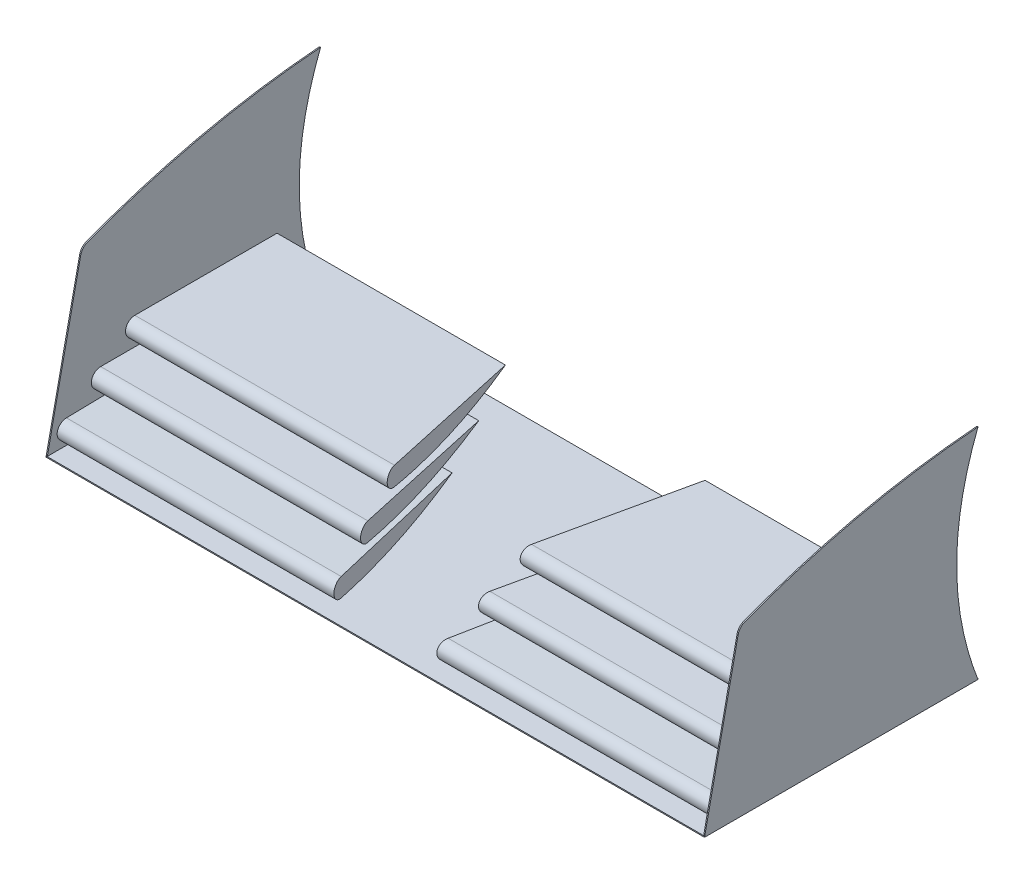
from build123d import *

# Parameters (mm, degrees)
BOSS_EXTRUDE1_START      = 762
SKETCH1_W                = 635
SKETCH1_H                = 508
BOSS_EXTRUDE1_DEPTH      = 2.54
CUT_EXTRUDE1_DEPTH       = 1117.158775265
CUT_EXTRUDE1_DEPTH_BACK  = 1117.158775265
CUT_EXTRUDE2_DEPTH       = 1117.158775435
CUT_EXTRUDE2_DEPTH_BACK  = 1117.158775435
BOSS_EXTRUDE2_DEPTH      = 762
BOSS_EXTRUDE2_DEPTH_BACK = 764.54
SKETCH6_W                = 1529.0800025
SKETCH6_H                = 635
BOSS_EXTRUDE3_DEPTH      = 2.54
CUT_EXTRUDE3_DEPTH       = 182.122850144


with BuildPart() as part:
    # Sketch1 → Boss-Extrude1 (new body)
    with BuildSketch(Plane(origin=(0, 0, 0), x_dir=(0, 0, -1), z_dir=(1, 0, 0)).offset(BOSS_EXTRUDE1_START)):
        with Locations((317.5, 254)):
            Rectangle(SKETCH1_W, SKETCH1_H)
    extrude(amount=BOSS_EXTRUDE1_DEPTH)


with BuildPart() as body_2:
    # Mirror2: mirrored copy
    add(part.part.mirror(Plane(origin=(0, 0, 0), x_dir=(0, 0, 1), z_dir=(1, 0, 0))))


with BuildPart() as cut_extrude1_tool:
    # Sketch2 → Cut-Extrude1 (new, two sides: drawn at the far end of the back side and taken through both)
    with BuildSketch(Plane(origin=(0, 0, 0), x_dir=(0, 0, -1), z_dir=(1, 0, 0)).offset(-CUT_EXTRUDE1_DEPTH_BACK)):
        with BuildLine():
            Line((635, 508), (635, 0))
            add(Edge.make_bspline(
                [(635, 508), (535.978469305, 253.949693989), (635, 0)],
                knots=[0, 0, 0, 1, 1, 1], degree=2))
        make_face()
    extrude(amount=CUT_EXTRUDE1_DEPTH + CUT_EXTRUDE1_DEPTH_BACK)


with BuildPart() as part_1:
    add(part.part)

    # Cut-Extrude1: cut by cut_extrude1_tool
    add(cut_extrude1_tool.part, mode=Mode.SUBTRACT)


with BuildPart() as body_2_1:
    add(body_2.part)

    # Cut-Extrude1: cut by cut_extrude1_tool
    add(cut_extrude1_tool.part, mode=Mode.SUBTRACT)


with BuildPart() as cut_extrude2_tool:
    # Sketch3 → Cut-Extrude2 (new, two sides: drawn at the far end of the back side and taken through both)
    with BuildSketch(Plane(origin=(0, 0, 0), x_dir=(0, 0, -1), z_dir=(1, 0, 0)).offset(-CUT_EXTRUDE2_DEPTH_BACK)):
        with BuildLine():
            Line((0, 0), (78.126052631, 368.542434052))
            ThreePointArc((78.126052631, 368.542434052), (83.696209203, 379.813815366), (93.989588341, 387.033027713))
            add(Edge.make_bspline(
                [(635, 508), (448.701490757, 493.282812039), (268.257998273, 452.93411167), (93.989588341, 387.033027713)],
                knots=[0, 0, 0, 0, 0.975723085, 0.975723085, 0.975723085, 0.975723085], degree=3))
            Line((635, 508), (0, 508))
            Line((0, 508), (0, 0))
        make_face()
    extrude(amount=CUT_EXTRUDE2_DEPTH + CUT_EXTRUDE2_DEPTH_BACK)


with BuildPart() as part_2:
    add(part_1.part)

    # Cut-Extrude2: cut by cut_extrude2_tool
    add(cut_extrude2_tool.part, mode=Mode.SUBTRACT)



with BuildPart() as body_2_2:
    add(body_2_1.part)

    # Cut-Extrude2: cut by cut_extrude2_tool
    add(cut_extrude2_tool.part, mode=Mode.SUBTRACT)


with BuildPart() as part_3:
    add(part_2.part)

    add(body_2_2.part)  # Boss-Extrude2 merges body 2
    # Sketch4 → Boss-Extrude2 (add, two sides: drawn at the far end of the back side and taken through both)
    with BuildSketch(Plane(origin=(0, 0, 0), x_dir=(0, 0, -1), z_dir=(1, 0, 0)).offset(-BOSS_EXTRUDE2_DEPTH_BACK)):
        with BuildLine():
            Line((45.081165504, 57.724816481), (375.281165504, 64.574520115))
            add(Edge.make_bspline(
                [(375.281165504, 64.574520115), (213.984471731, 12.310346682), (45.081165504, 14.405048326)],
                knots=[0, 0, 0, 1, 1, 1], degree=2))
            ThreePointArc((45.081165504, 14.405048326), (23.421281427, 36.064932403), (45.081165504, 57.724816481))
        make_face()
        with BuildLine():
            Line((124.417436543, 121.193833312), (454.617436543, 121.193833312))
            add(Edge.make_bspline(
                [(454.617436543, 121.193833312), (292.934450552, 71.316103557), (124.417436543, 77.874065157)],
                knots=[0, 0, 0, 1, 1, 1], degree=2))
            ThreePointArc((124.417436543, 77.874065157), (102.757552466, 99.533949235), (124.417436543, 121.193833312))
        make_face()
        with BuildLine():
            Line((203.753707583, 184.662850144), (533.953707583, 184.662850144))
            add(Edge.make_bspline(
                [(203.753707583, 141.343081989), (373.054781607, 130.66856222), (533.953707583, 184.662850144)],
                knots=[0, 0, 0, 1, 1, 1], degree=2))
            ThreePointArc((203.753707583, 141.343081989), (182.093823506, 163.002966066), (203.753707583, 184.662850144))
        make_face()
    extrude(amount=BOSS_EXTRUDE2_DEPTH + BOSS_EXTRUDE2_DEPTH_BACK)

    # Sketch6 → Boss-Extrude3 (add)
    with BuildSketch(Plane(origin=(0, 0, 0), x_dir=(1, 0, 0), z_dir=(0, 1, 0))):
        with Locations((-1.25e-06, 317.5)):
            Rectangle(SKETCH6_W, SKETCH6_H)
    extrude(amount=BOSS_EXTRUDE3_DEPTH)

    # Sketch7 → Cut-Extrude3 (cut)
    with BuildSketch(Plane(origin=(0, 184.662850144, 0), x_dir=(1, 0, 0), z_dir=(0, 1, 0))):
        Polygon((-254, 635), (-114.3, 0), (114.3, 0), (254, 635), align=None)
    extrude(amount=-CUT_EXTRUDE3_DEPTH, mode=Mode.SUBTRACT)


solid = part_3.part
